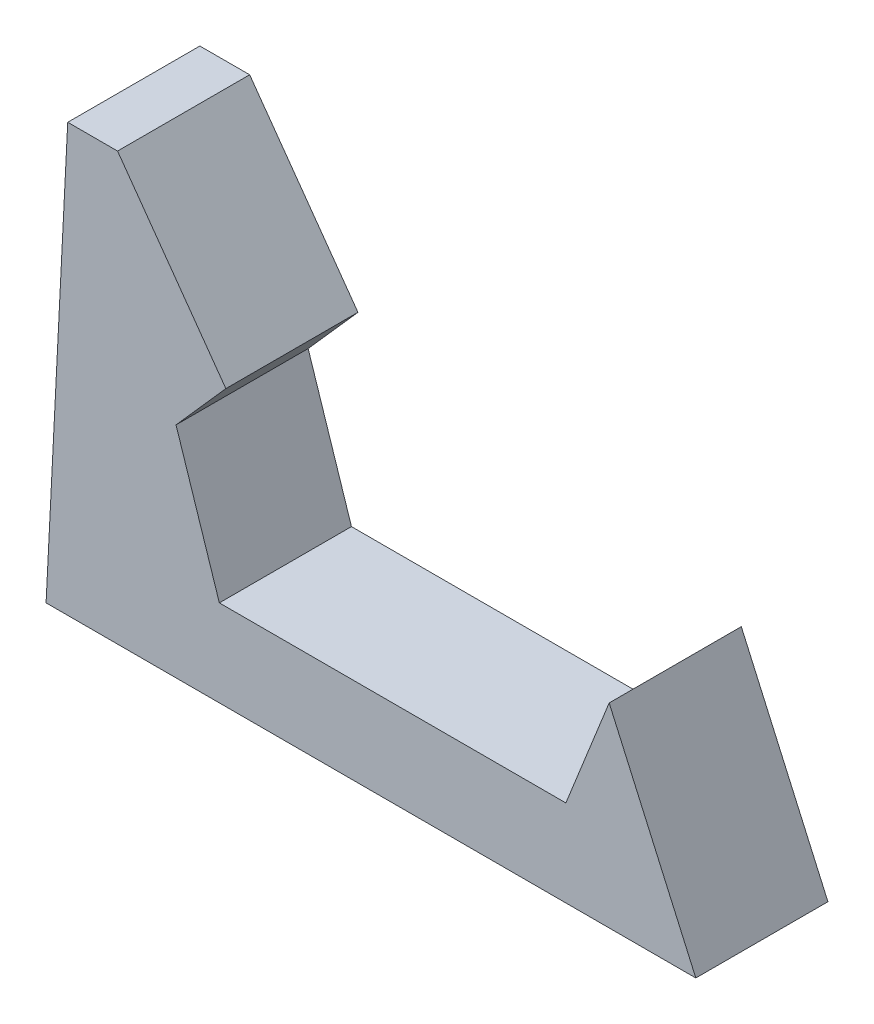
from build123d import *

# Parameters (mm, degrees)
EXTRUDE1_DEPTH = 30.5


with BuildPart() as part:
    # Sketch2 → Extrude1 (new body)
    with BuildSketch(Plane.XY):
        Polygon((-61.402059979, 240.939839483), (-66.402059979, 142.348974725), (83.597940021, 142.348974725), (63.597940021, 187.348974725), (53.597940021, 162.348974725), (-26.402059979, 162.348974725), (-36.402059979, 192.939839483), (-24.902059979, 205.939839483), (-49.902059979, 240.939839483), align=None)
    extrude(amount=EXTRUDE1_DEPTH)


solid = part.part
